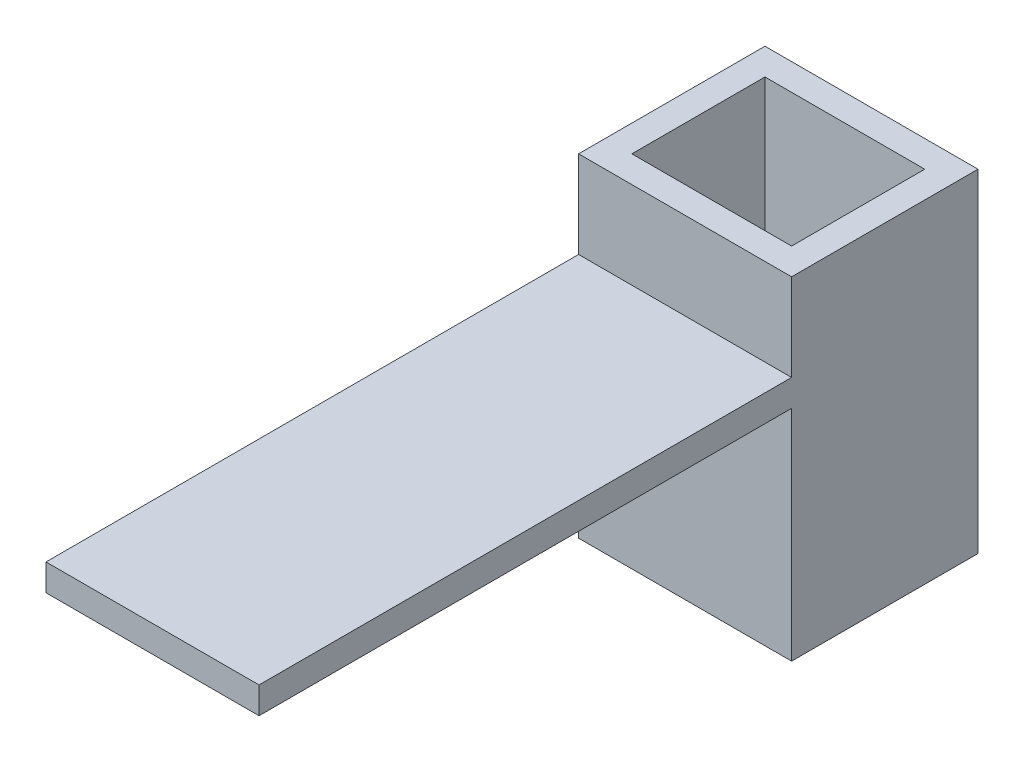
from build123d import *

# Parameters (mm, degrees)
SKETCH_1_W      = 12
SKETCH_1_H      = 10
EXTRUDE_1_DEPTH = 25
SHELL_1_T       = 2
SKETCH_2_W      = 16
SKETCH_2_H      = 2.007499683
EXTRUDE_2_DEPTH = 40


with BuildPart() as part:
    # 草图1 → 凸台-拉伸1 (new body)
    with BuildSketch(Plane(origin=(0, 0, 0), x_dir=(1, 0, 0), z_dir=(0, 1, 0))):
        with Locations((6, -5)):
            Rectangle(SKETCH_1_W, SKETCH_1_H)
    extrude(amount=EXTRUDE_1_DEPTH)

    # 抽壳1
    shell_1_openings = [part.faces().sort_by_distance(p)[0] for p in [
        (6, 0, 5),
        (6, 25, 5),
    ]]
    offset(amount=SHELL_1_T, openings=shell_1_openings, kind=Kind.INTERSECTION)

    # 草图2 → 凸台-拉伸2 (add)
    with BuildSketch(Plane.XY.offset(12)):
        with Locations((6, 17.450698372)):
            Rectangle(SKETCH_2_W, SKETCH_2_H)
    extrude(amount=EXTRUDE_2_DEPTH)


solid = part.part
